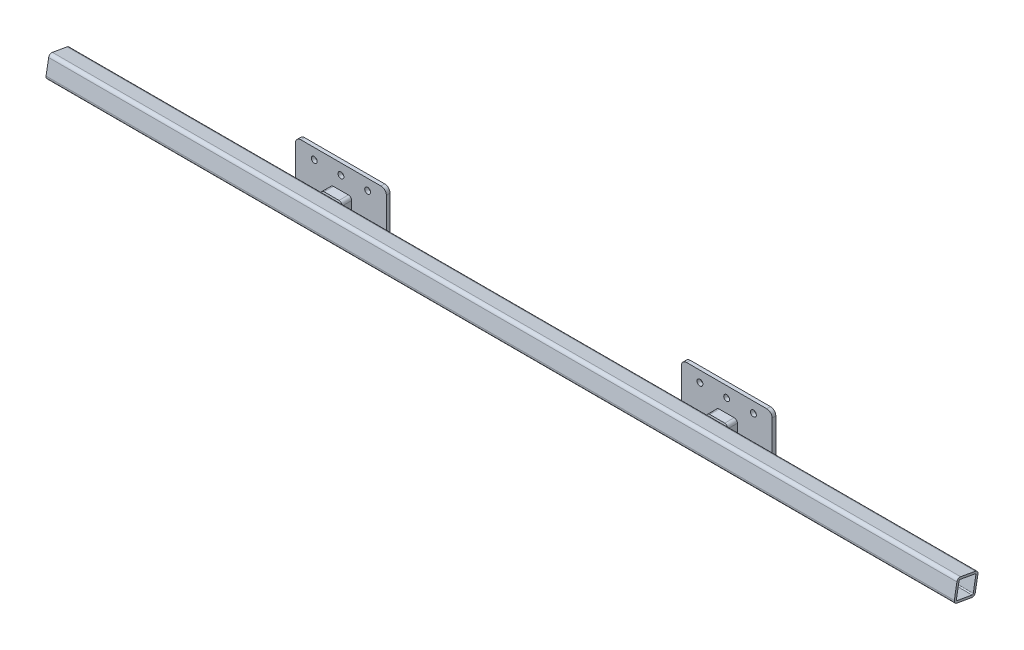
from build123d import *

# Parameters (mm, degrees)
DODANIE_WYCI_GNI_CIE1_DEPTH        = 5
DODANIE_WYCI_GNI_CIE1_DEPTH_BACK   = 2
SZKIC1_R                           = 5.5
DODANIE_WYCI_GNI_CIE1_2_DEPTH      = 5
DODANIE_WYCI_GNI_CIE1_2_DEPTH_BACK = 2
DODANIE_WYCI_GNI_CIE2_DEPTH        = 850
DODANIE_WYCI_GNI_CIE2_DEPTH_BACK   = 850
DODANIE_WYCI_GNI_CIE3_REACH        = 859.072
OTW_R_GWINTOWANY_M101_AT_2_COUNT   = 2
OTW_R_GWINTOWANY_M101_AT_2_PITCH   = 1600


with BuildPart() as part:
    # Szkic1 → Dodanie-wyciągnięcie1 (new, two sides: drawn at the far end of the back side and taken through both)
    with BuildSketch(Plane.XY.offset(-DODANIE_WYCI_GNI_CIE1_DEPTH_BACK)):
        with BuildLine():
            Line((-436, 0), (-286, 0))
            ThreePointArc((-286, 0), (-278.928932188, 2.928932188), (-276, 10))
            Line((-276, 10), (-276, 80))
            ThreePointArc((-276, 80), (-278.928932188, 87.071067812), (-286, 90))
            Line((-286, 90), (-436, 90))
            ThreePointArc((-436, 90), (-443.071067812, 87.071067812), (-446, 80))
            Line((-446, 80), (-446, 10))
            ThreePointArc((-446, 10), (-443.071067812, 2.928932188), (-436, 0))
        make_face()
        with Locations((-411, 70)):
            Circle(SZKIC1_R, mode=Mode.SUBTRACT)
        with Locations((-361, 70)):
            Circle(SZKIC1_R, mode=Mode.SUBTRACT)
        with Locations((-311, 70)):
            Circle(SZKIC1_R, mode=Mode.SUBTRACT)
    extrude(amount=DODANIE_WYCI_GNI_CIE1_DEPTH + DODANIE_WYCI_GNI_CIE1_DEPTH_BACK)


with BuildPart() as body_2:
    # Szkic1 → Dodanie-wyci_gni_cie1 2 (new, two sides: drawn at the far end of the back side and taken through both)
    with BuildSketch(Plane.XY.offset(-DODANIE_WYCI_GNI_CIE1_2_DEPTH_BACK)):
        with BuildLine():
            Line((276, 10), (276, 80))
            ThreePointArc((276, 80), (278.928932188, 87.071067812), (286, 90))
            Line((286, 90), (436, 90))
            ThreePointArc((436, 90), (443.071067812, 87.071067812), (446, 80))
            Line((446, 80), (446, 10))
            ThreePointArc((446, 10), (443.071067812, 2.928932188), (436, 0))
            Line((436, 0), (286, 0))
            ThreePointArc((286, 0), (278.928932188, 2.928932188), (276, 10))
        make_face()
        with Locations(Location((311, 70, 0), (0, 0, 180))):
            Circle(SZKIC1_R, mode=Mode.SUBTRACT)
        with Locations(Location((361, 70, 0), (0, 0, 180))):
            Circle(SZKIC1_R, mode=Mode.SUBTRACT)
        with Locations(Location((411, 70, 0), (0, 0, 180))):
            Circle(SZKIC1_R, mode=Mode.SUBTRACT)
    extrude(amount=DODANIE_WYCI_GNI_CIE1_2_DEPTH + DODANIE_WYCI_GNI_CIE1_2_DEPTH_BACK)


with BuildPart() as body_3:
    # Szkic2 → Dodanie-wyciągnięcie2 (new, two sides: drawn at the far end of the back side and taken through both)
    with BuildSketch(Plane(origin=(0, 0, 0), x_dir=(0, 0, -1), z_dir=(1, 0, 0)).offset(-DODANIE_WYCI_GNI_CIE2_DEPTH_BACK)):
        with BuildLine():
            Line((-28.543754975, 45.434199186), (-56.118372059, 50.296348161))
            ThreePointArc((-56.118372059, 50.296348161), (-60.601719743, 49.302413909), (-63.069107643, 45.429390709))
            Line((-63.069107643, 45.429390709), (-67.931256618, 17.854773625))
            ThreePointArc((-67.931256618, 17.854773625), (-66.937322366, 13.371425941), (-63.064299166, 10.904038041))
            Line((-63.064299166, 10.904038041), (-35.489682082, 6.041889066))
            ThreePointArc((-35.489682082, 6.041889066), (-31.006334398, 7.035823318), (-28.538946498, 10.908846518))
            Line((-28.538946498, 10.908846518), (-23.676797523, 38.483463602))
            ThreePointArc((-23.676797523, 38.483463602), (-24.670731775, 42.966811287), (-28.543754975, 45.434199186))
        make_face()
        with BuildLine():
            Line((-29.238347686, 41.494968174), (-56.81296477, 46.357117149))
            ThreePointArc((-56.81296477, 46.357117149), (-58.307413998, 46.025805732), (-59.129876631, 44.734797998))
            Line((-59.129876631, 44.734797998), (-63.992025606, 17.160180914))
            ThreePointArc((-63.992025606, 17.160180914), (-63.660714189, 15.665731686), (-62.369706455, 14.843269053))
            Line((-62.369706455, 14.843269053), (-34.795089371, 9.981120078))
            ThreePointArc((-34.795089371, 9.981120078), (-33.300640143, 10.312431495), (-32.47817751, 11.603439229))
            Line((-32.47817751, 11.603439229), (-27.616028535, 39.178056313))
            ThreePointArc((-27.616028535, 39.178056313), (-27.947339952, 40.672505541), (-29.238347686, 41.494968174))
        make_face(mode=Mode.SUBTRACT)
    extrude(amount=DODANIE_WYCI_GNI_CIE2_DEPTH + DODANIE_WYCI_GNI_CIE2_DEPTH_BACK)

    # Szkic5 → Otwór gwintowany M101 (revolve, cut)
    with BuildSketch(Plane(origin=(-800, 8.472963553, 49.276990624), x_dir=(0, -0.17364817766693064, -0.9848077530122081), z_dir=(1, 0, 0))):
        Polygon((0, 0), (0, 30.053657631), (4.25, 27.5), (4.25, 0), align=None)
    otw_r_gwintowany_m101 = revolve(axis=Axis((-800, 2.219434322, 50.379656552), (0, 0.9848077530122081, -0.17364817766693066)), mode=Mode.SUBTRACT)

    # Otwór gwintowany M101 at 2: Otwór gwintowany M101 ×2
    with Locations(*[(i * OTW_R_GWINTOWANY_M101_AT_2_PITCH, 0, 0) for i in range(1, OTW_R_GWINTOWANY_M101_AT_2_COUNT)]):
        add(otw_r_gwintowany_m101, mode=Mode.SUBTRACT)


with BuildPart() as body_4:
    # Dodanie-wyciągnięcie3: up to this plane
    dodanie_wyci_gni_cie3_end = Plane(origin=(-850, 10.908846518, 28.538946498), z_dir=(0, -0.17364817766693066, -0.984807753012208))
    # Szkic3 → Dodanie-wyciągnięcie3 (new, up to the surface)
    with BuildSketch(Plane(origin=(0, 0, 5), x_dir=(-1, 0, 0), z_dir=(0, 0, -1)), mode=Mode.PRIVATE) as dodanie_wyci_gni_cie3_sk1:
        with BuildLine():
            Line((375, 45), (347, 45))
            ThreePointArc((347, 45), (342.757359313, 43.242640687), (341, 39))
            Line((341, 39), (341, 11))
            ThreePointArc((341, 11), (342.757359313, 6.757359313), (347, 5))
            Line((347, 5), (375, 5))
            ThreePointArc((375, 5), (379.242640687, 6.757359313), (381, 11))
            Line((381, 11), (381, 39))
            ThreePointArc((381, 39), (379.242640687, 43.242640687), (375, 45))
        make_face()
        with BuildLine():
            Line((375, 41), (347, 41))
            ThreePointArc((347, 41), (345.585786438, 40.414213562), (345, 39))
            Line((345, 39), (345, 11))
            ThreePointArc((345, 11), (345.585786438, 9.585786438), (347, 9))
            Line((347, 9), (375, 9))
            ThreePointArc((375, 9), (376.414213562, 9.585786438), (377, 11))
            Line((377, 11), (377, 39))
            ThreePointArc((377, 39), (376.414213562, 40.414213562), (375, 41))
        make_face(mode=Mode.SUBTRACT)
    dodanie_wyci_gni_cie3_tool1 = split(extrude(dodanie_wyci_gni_cie3_sk1.sketch, amount=-DODANIE_WYCI_GNI_CIE3_REACH, mode=Mode.PRIVATE), bisect_by=dodanie_wyci_gni_cie3_end, keep=Keep.BOTH, mode=Mode.PRIVATE)
    add(dodanie_wyci_gni_cie3_tool1.solids().sort_by_distance((-361, 44.434315, 5))[0])
    # Szkic3 → Dodanie-wyciągnięcie3 (new, up to the surface)
    with BuildSketch(Plane(origin=(0, 0, 5), x_dir=(-1, 0, 0), z_dir=(0, 0, -1)), mode=Mode.PRIVATE) as dodanie_wyci_gni_cie3_sk2:
        with BuildLine():
            Line((-381, 11), (-381, 39))
            ThreePointArc((-381, 39), (-379.242640687, 43.242640687), (-375, 45))
            Line((-375, 45), (-347, 45))
            ThreePointArc((-347, 45), (-342.757359313, 43.242640687), (-341, 39))
            Line((-341, 39), (-341, 11))
            ThreePointArc((-341, 11), (-342.757359313, 6.757359313), (-347, 5))
            Line((-347, 5), (-375, 5))
            ThreePointArc((-375, 5), (-379.242640687, 6.757359313), (-381, 11))
        make_face()
        with BuildLine():
            Line((-377, 11), (-377, 39))
            ThreePointArc((-377, 39), (-376.414213562, 40.414213562), (-375, 41))
            Line((-375, 41), (-347, 41))
            ThreePointArc((-347, 41), (-345.585786438, 40.414213562), (-345, 39))
            Line((-345, 39), (-345, 11))
            ThreePointArc((-345, 11), (-345.585786438, 9.585786438), (-347, 9))
            Line((-347, 9), (-375, 9))
            ThreePointArc((-375, 9), (-376.414213562, 9.585786438), (-377, 11))
        make_face(mode=Mode.SUBTRACT)
    dodanie_wyci_gni_cie3_tool2 = split(extrude(dodanie_wyci_gni_cie3_sk2.sketch, amount=-DODANIE_WYCI_GNI_CIE3_REACH, mode=Mode.PRIVATE), bisect_by=dodanie_wyci_gni_cie3_end, keep=Keep.BOTH, mode=Mode.PRIVATE)
    add(dodanie_wyci_gni_cie3_tool2.solids().sort_by_distance((378.842641, 7.157359, 5))[0])


solid = Compound([part.part, body_2.part, body_3.part, body_4.part])
